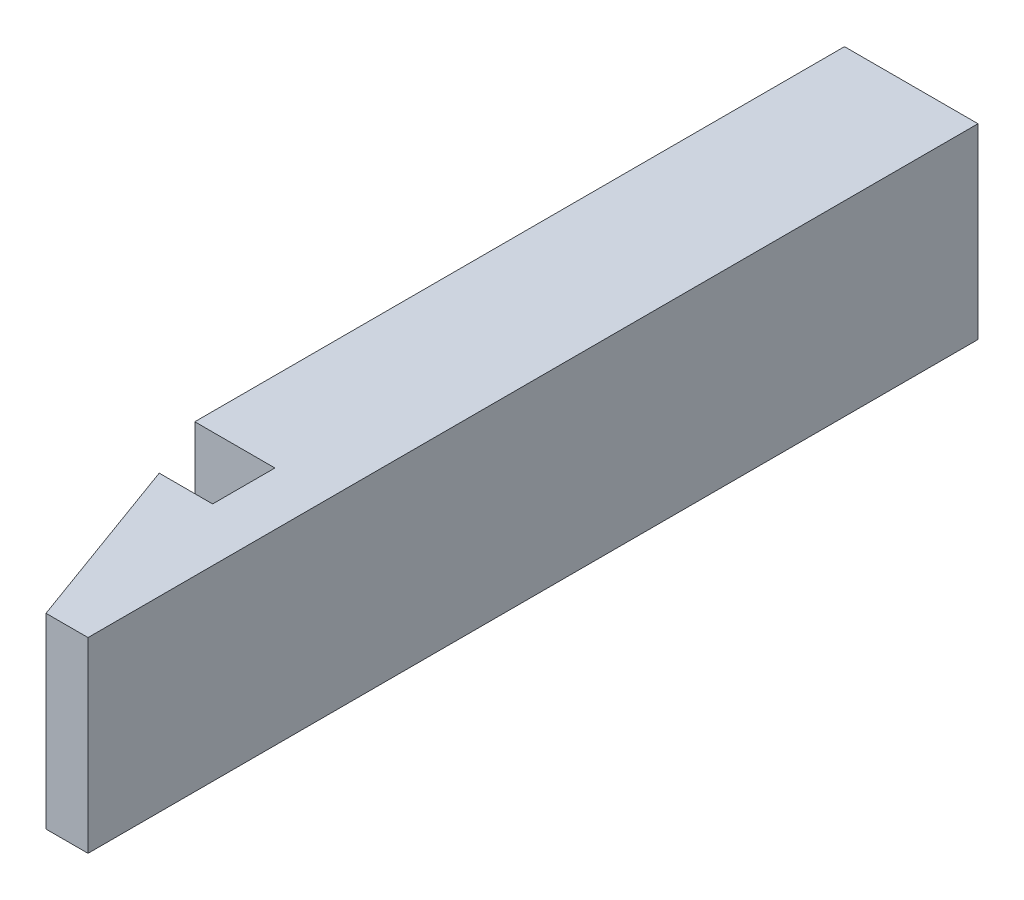
from build123d import *

# Parameters (mm, degrees)
SKETCH2_W           = 3.81
SKETCH2_H           = 25.4
BOSS_EXTRUDE1_DEPTH = 5.334
SKETCH3_OUTSIDE_W   = 11.056
SKETCH3_OUTSIDE_H   = 32.646
CUT_EXTRUDE1_DEPTH  = 27.232187404


with BuildPart() as part:
    # Sketch2 → Boss-Extrude1 (new body)
    with BuildSketch(Plane(origin=(0, 0, 0), x_dir=(1, 0, 0), z_dir=(0, 1, 0))):
        with Locations((1.905, 12.7)):
            Rectangle(SKETCH2_W, SKETCH2_H)
    extrude(amount=BOSS_EXTRUDE1_DEPTH)

    # Sketch3 outside → Cut-Extrude1 (cut, through all)
    with BuildSketch(Plane(origin=(0, 5.334, 0), x_dir=(1, 0, 0), z_dir=(0, 1, 0))):
        with Locations((1.905, 12.7)):
            Rectangle(SKETCH3_OUTSIDE_W, SKETCH3_OUTSIDE_H)
        Polygon((0.762, 5.08), (2.61096879, 0), (3.81, 0), (3.81, 25.4), (0, 25.4), (0, 6.858), (2.286, 6.858), (2.286, 5.08), align=None, mode=Mode.SUBTRACT)
    extrude(amount=-CUT_EXTRUDE1_DEPTH, mode=Mode.SUBTRACT)


solid = part.part
